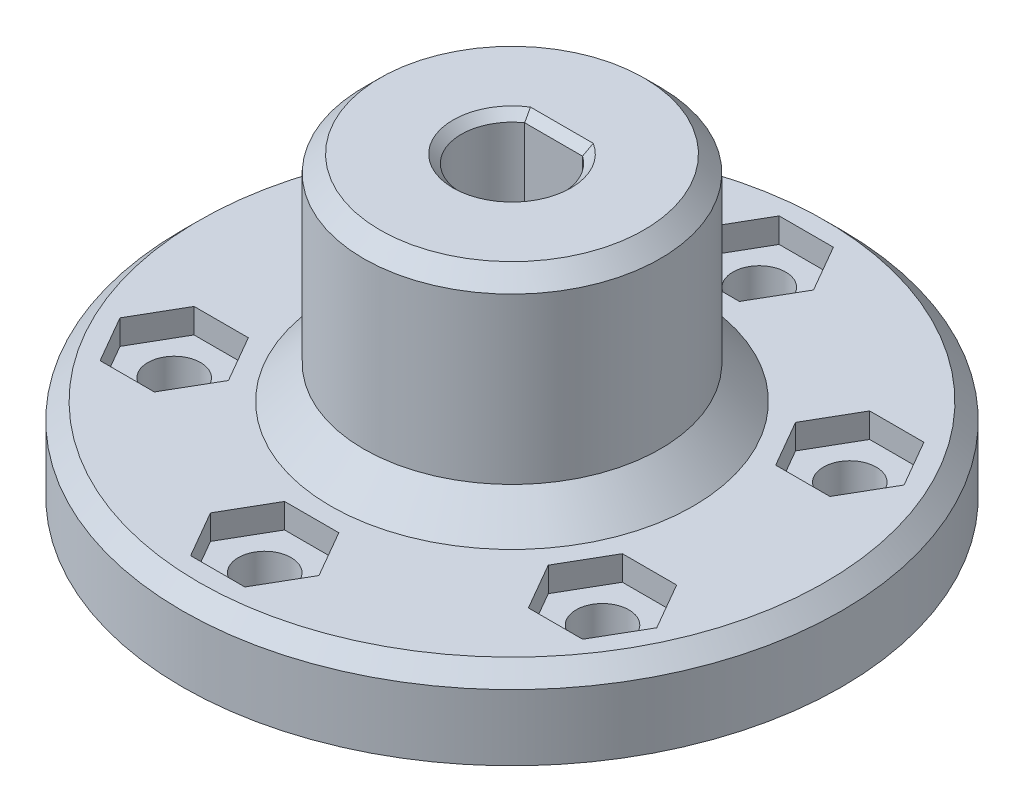
from build123d import *

# Parameters (mm, degrees)
SKETCH1_R           = 20
BOSS_EXTRUDE1_DEPTH = 5
SKETCH2_R           = 1.6
CUT_EXTRUDE1_DEPTH  = 29.722813233
SKETCH3_R           = 9
BOSS_EXTRUDE2_DEPTH = 13
CUT_EXTRUDE2_DEPTH  = 34.526109228
CHAMFER3_SIZE       = 2
CHAMFER4_SIZE       = 1
CHAMFER5_SIZE       = 1
CHAMFER6_SIZE       = 0.5
CUT_EXTRUDE7_DEPTH  = 1.5


with BuildPart() as part:
    # Sketch1 → Boss-Extrude1 (new body)
    with BuildSketch(Plane(origin=(0, 0, 0), x_dir=(1, 0, 0), z_dir=(0, 1, 0))):
        with Locations(Location((0, 0, 0), (0, 0, 270))):
            Circle(SKETCH1_R)
    extrude(amount=BOSS_EXTRUDE1_DEPTH)

    # Sketch2 → Cut-Extrude1 (cut, through all)
    with BuildSketch(Plane(origin=(0, 5, 0), x_dir=(1, 0, 0), z_dir=(0, 1, 0))):
        with Locations(Location((0, 15, 0), (0, 0, 270))):
            Circle(SKETCH2_R)
        with Locations(Location((12.990381057, 7.5, 0), (0, 0, 270))):
            Circle(SKETCH2_R)
        with Locations(Location((12.990381057, -7.5, 0), (0, 0, 270))):
            Circle(SKETCH2_R)
        with Locations(Location((0, -15, 0), (0, 0, 270))):
            Circle(SKETCH2_R)
        with Locations(Location((-12.990381057, -7.5, 0), (0, 0, 270))):
            Circle(SKETCH2_R)
        with Locations(Location((-12.990381057, 7.5, 0), (0, 0, 270))):
            Circle(SKETCH2_R)
    extrude(amount=-CUT_EXTRUDE1_DEPTH, mode=Mode.SUBTRACT)

    # Sketch3 → Boss-Extrude2 (add)
    with BuildSketch(Plane(origin=(0, 5, 0), x_dir=(1, 0, 0), z_dir=(0, 1, 0))):
        with Locations(Location((0, 0, 0), (0, 0, 90))):
            Circle(SKETCH3_R)
    extrude(amount=BOSS_EXTRUDE2_DEPTH)

    # Sketch4 → Cut-Extrude2 (cut, through all)
    with BuildSketch(Plane(origin=(0, 18, 0), x_dir=(1, 0, 0), z_dir=(0, 1, 0))):
        with BuildLine():
            Line((1.754992877, 2.525), (-1.754992877, 2.525))
            ThreePointArc((-1.754992877, 2.525), (-1.424609052, -2.725089732), (3.075, 0))
            ThreePointArc((3.075, 0), (2.725089732, 1.424609052), (1.754992877, 2.525))
        make_face()
    extrude(amount=-CUT_EXTRUDE2_DEPTH, mode=Mode.SUBTRACT)

    # Chamfer3
    chamfer3_edges = [part.edges().sort_by_distance(p)[0] for p in [
        (0, 5, 9),
    ]]
    chamfer(chamfer3_edges, length=CHAMFER3_SIZE)

    # Chamfer4
    chamfer4_edges = [part.edges().sort_by_distance(p)[0] for p in [
        (0, 5, -20),
    ]]
    chamfer(chamfer4_edges, length=CHAMFER4_SIZE)

    # Chamfer5
    chamfer5_edges = [part.edges().sort_by_distance(p)[0] for p in [
        (0, 18, 9),
    ]]
    chamfer(chamfer5_edges, length=CHAMFER5_SIZE)

    # Chamfer6
    chamfer6_edges = [part.edges().sort_by_distance(p)[0] for p in [
        (0, 18, -2.525),
        (0, 18, 3.075),
    ]]
    chamfer(chamfer6_edges, length=CHAMFER6_SIZE)

    # Sketch10 → Cut-Extrude7 (cut)
    with BuildSketch(Plane(origin=(0, 5, 0), x_dir=(1, 0, 0), z_dir=(0, 1, 0))):
        Polygon((1.645448267, 17.85), (-1.645448267, 17.85), (-3.290896534, 15), (-1.645448267, 12.15), (1.645448267, 12.15), (3.290896534, 15), align=None)
        Polygon((14.635829324, 10.35), (11.34493279, 10.35), (9.699484522, 7.5), (11.34493279, 4.65), (14.635829324, 4.65), (16.281277591, 7.5), align=None)
        Polygon((-11.34493279, 10.35), (-14.635829324, 10.35), (-16.281277591, 7.5), (-14.635829324, 4.65), (-11.34493279, 4.65), (-9.699484522, 7.5), align=None)
    cut_extrude7 = extrude(amount=-CUT_EXTRUDE7_DEPTH, mode=Mode.SUBTRACT)

    # Mirror2: Cut-Extrude7 across plane
    add(cut_extrude7.mirror(Plane.XY), mode=Mode.SUBTRACT)


solid = part.part
